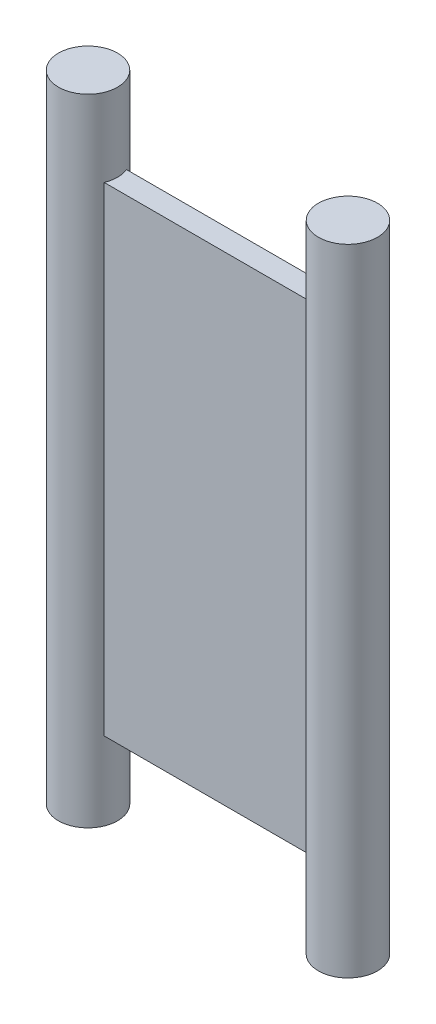
from build123d import *

# Parameters (mm, degrees)
SKETCH1_W           = 11.66
SKETCH1_H           = 1
BOSS_EXTRUDE1_DEPTH = 21.5
SKETCH2_R           = 1.325
BOSS_EXTRUDE2_DEPTH = 14.25


with BuildPart() as part:
    # Sketch1 → Boss-Extrude1 (new body)
    with BuildSketch(Plane(origin=(0, 0, 0), x_dir=(1, 0, 0), z_dir=(0, 1, 0))):
        Rectangle(SKETCH1_W, SKETCH1_H)
    extrude(amount=BOSS_EXTRUDE1_DEPTH)

    # Sketch2 → Boss-Extrude2 (add, symmetric)
    with BuildSketch(Plane(origin=(0, 10.75, 0), x_dir=(1, 0, 0), z_dir=(0, 1, 0))):
        with Locations(Location((-5.83, 0, 0), (0, 0, 270))):
            Circle(SKETCH2_R)
        with Locations(Location((5.83, 0, 0), (0, 0, 270))):
            Circle(SKETCH2_R)
    extrude(amount=BOSS_EXTRUDE2_DEPTH, both=True)


solid = part.part
